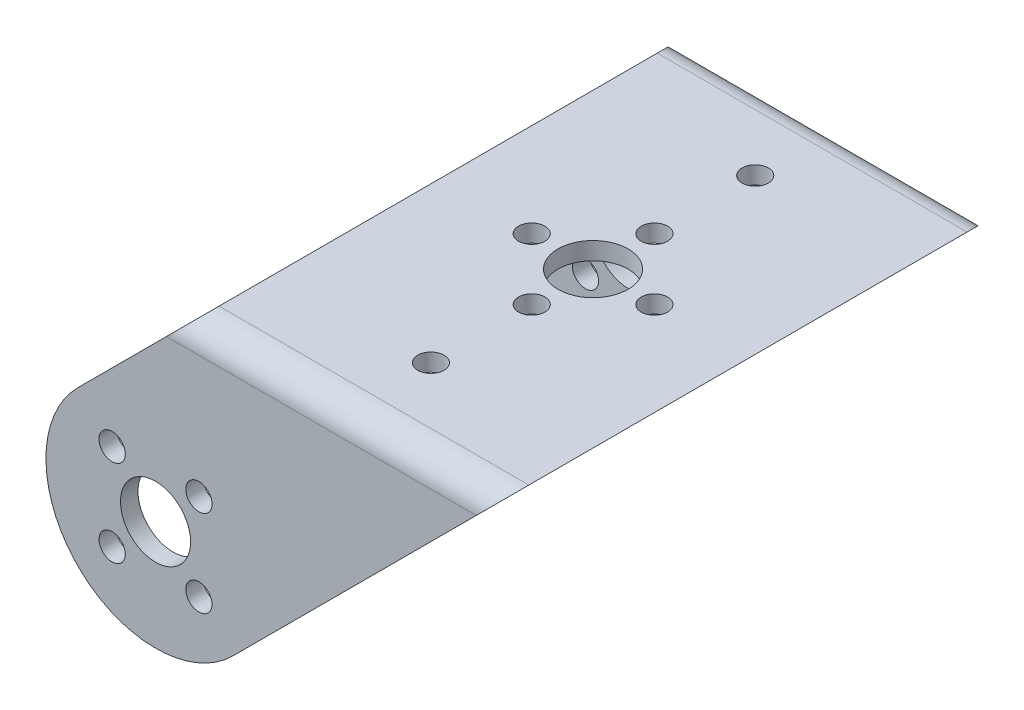
from build123d import *

# Parameters (mm, degrees)
SKETCH_1_R          = 4
SKETCH_1_R_2        = 1.5
EXTRUDE_1_DEPTH     = 2
EXTRUDE_2_DEPTH     = 52
EXTRUDE_START       = 2
SKETCH_3_R          = 4
SKETCH_3_R_2        = 1.5
EXTRUDE_3_DEPTH     = 2
FILLET_1_R          = 3
FILLET_2_R          = 1
SKETCH_4_R          = 4
SKETCH_4_R_2        = 1.5
CUT_EXTRUDE_1_DEPTH = 2
SKETCH_5_R          = 1.5
CUT_EXTRUDE_2_DEPTH = 2


with BuildPart() as part:
    # 草图1 → 凸台-拉伸1 (new body)
    with BuildSketch(Plane.XY):
        with BuildLine():
            Line((8.838834765, -8.838834765), (39.597979746, 21.920310217))
            Line((39.597979746, 21.920310217), (4.242640687, 21.920310217))
            Line((4.242640687, 21.920310217), (-8.838834765, 8.838834765))
            ThreePointArc((-8.838834765, 8.838834765), (-8.838834765, -8.838834765), (8.838834765, -8.838834765))
        make_face()
        Circle(SKETCH_1_R, mode=Mode.SUBTRACT)
        with Locations((4.949747468, -4.949747468)):
            Circle(SKETCH_1_R_2, mode=Mode.SUBTRACT)
        with Locations((-4.949747468, -4.949747468)):
            Circle(SKETCH_1_R_2, mode=Mode.SUBTRACT)
        with Locations((-4.949747468, 4.949747468)):
            Circle(SKETCH_1_R_2, mode=Mode.SUBTRACT)
        with Locations((4.949747468, 4.949747468)):
            Circle(SKETCH_1_R_2, mode=Mode.SUBTRACT)
    extrude(amount=EXTRUDE_1_DEPTH)

    # 草图2 → 凸台-拉伸2 (add)
    with BuildSketch(Plane(origin=(0, 0, 0), x_dir=(-1, 0, 0), z_dir=(0, 0, -1))):
        Polygon((-39.597979746, 21.920310217), (-4.242640687, 21.920310217), (-2.242640687, 19.920310217), (-37.597979746, 19.920310217), align=None)
    extrude(amount=EXTRUDE_2_DEPTH)

    # 草图3 → 凸台-拉伸3 (add)
    with BuildSketch(Plane(origin=(0, 0, -52), x_dir=(-1, 0, 0), z_dir=(0, 0, -1)).offset(EXTRUDE_START)):
        with BuildLine():
            Line((-2.242640687, 19.920310217), (-4.242640687, 21.920310217))
            Line((-4.242640687, 21.920310217), (-39.597979746, 21.920310217))
            Line((-39.597979746, 21.920310217), (-37.597979746, 19.920310217))
            Line((-37.597979746, 19.920310217), (-8.838834765, -8.838834765))
            ThreePointArc((-8.838834765, -8.838834765), (8.838834765, -8.838834765), (8.838834765, 8.838834765))
            Line((8.838834765, 8.838834765), (-2.242640687, 19.920310217))
        make_face()
        with Locations(Location((0, 0, 0), (0, 0, 180))):
            Circle(SKETCH_3_R, mode=Mode.SUBTRACT)
        with Locations(Location((-4.949747468, -4.949747468, 0), (0, 0, 180))):
            Circle(SKETCH_3_R_2, mode=Mode.SUBTRACT)
        with Locations(Location((-4.949747468, 4.949747468, 0), (0, 0, 180))):
            Circle(SKETCH_3_R_2, mode=Mode.SUBTRACT)
        with Locations(Location((4.949747468, 4.949747468, 0), (0, 0, 180))):
            Circle(SKETCH_3_R_2, mode=Mode.SUBTRACT)
        with Locations(Location((4.949747468, -4.949747468, 0), (0, 0, 180))):
            Circle(SKETCH_3_R_2, mode=Mode.SUBTRACT)
    extrude(amount=-EXTRUDE_3_DEPTH)

    # 圆角1
    fillet_1_edges = [part.edges().sort_by_distance(p)[0] for p in [
        (21.920310217, 21.920310217, -54),
        (21.920310217, 21.920310217, 2),
    ]]
    fillet(fillet_1_edges, radius=FILLET_1_R)

    # 圆角2
    fillet_2_edges = [part.edges().sort_by_distance(p)[0] for p in [
        (19.920310217, 19.920310217, 0),
        (19.920310217, 19.920310217, -52),
    ]]
    fillet(fillet_2_edges, radius=FILLET_2_R)

    # 草图4 → 切除-拉伸1 (cut)
    with BuildSketch(Plane(origin=(0, 21.920310217, 0), x_dir=(1, 0, 0), z_dir=(0, 1, 0))):
        with Locations(Location((21.920310217, 26, 0), (0, 0, 180))):
            Circle(SKETCH_4_R)
        with Locations(Location((14.920310217, 26, 0), (0, 0, 180))):
            Circle(SKETCH_4_R_2)
        with Locations(Location((21.920310217, 33, 0), (0, 0, 180))):
            Circle(SKETCH_4_R_2)
        with Locations(Location((28.920310217, 26, 0), (0, 0, 180))):
            Circle(SKETCH_4_R_2)
        with Locations(Location((21.920310217, 19, 0), (0, 0, 180))):
            Circle(SKETCH_4_R_2)
    extrude(amount=-CUT_EXTRUDE_1_DEPTH, mode=Mode.SUBTRACT)

    # 草图5 → 切除-拉伸2 (cut)
    with BuildSketch(Plane(origin=(0, 21.920310217, 0), x_dir=(1, 0, 0), z_dir=(0, 1, 0))):
        with Locations(Location((21.920310217, 44.5, 0), (0, 0, 180))):
            Circle(SKETCH_5_R)
        with Locations(Location((21.920310217, 7.5, 0), (0, 0, 180))):
            Circle(SKETCH_5_R)
    extrude(amount=-CUT_EXTRUDE_2_DEPTH, mode=Mode.SUBTRACT)


solid = part.part
